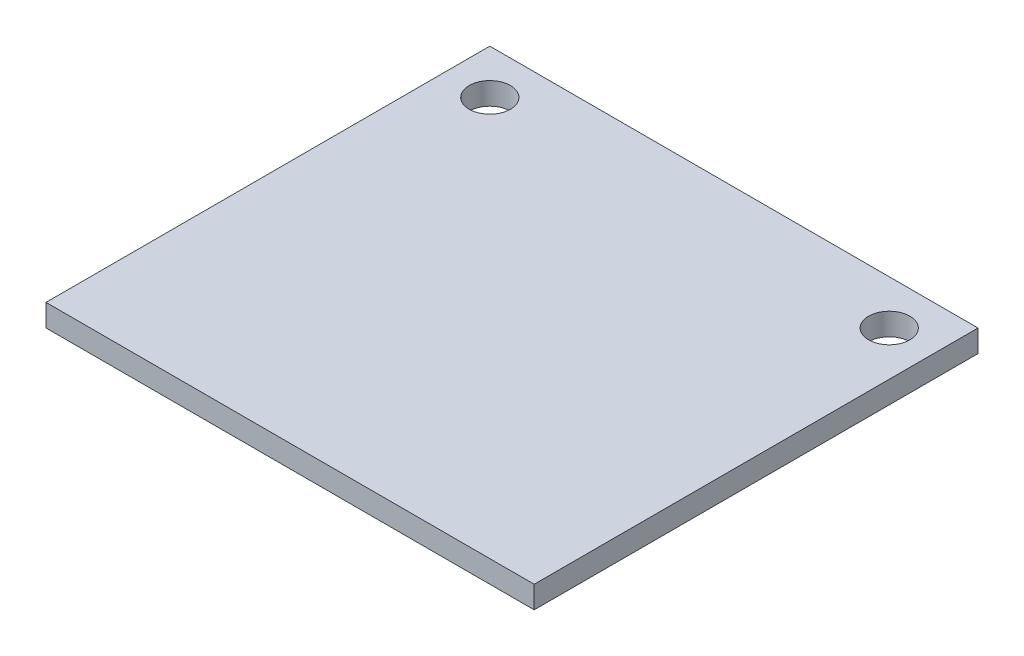
from build123d import *

# Parameters (mm, degrees)
SKETCH1_W           = 34.925
SKETCH1_H           = 31.75
BOSS_EXTRUDE1_DEPTH = 1.5875
SKETCH2_R           = 1.4732
CUT_EXTRUDE1_DEPTH  = 1.5875


with BuildPart() as part:
    # Sketch1 → Boss-Extrude1 (new body)
    with BuildSketch(Plane(origin=(0, 0, 0), x_dir=(1, 0, 0), z_dir=(0, 1, 0))):
        with Locations((17.4625, 15.875)):
            Rectangle(SKETCH1_W, SKETCH1_H)
    extrude(amount=BOSS_EXTRUDE1_DEPTH)

    # Sketch2 → Cut-Extrude1 (cut)
    with BuildSketch(Plane(origin=(0, 1.5875, 0), x_dir=(1, 0, 0), z_dir=(0, 1, 0))):
        with Locations(Location((3.175, 28.575, 0), (0, 0, 270))):
            Circle(SKETCH2_R)
        with Locations(Location((31.75, 28.575, 0), (0, 0, 270))):
            Circle(SKETCH2_R)
    extrude(amount=-CUT_EXTRUDE1_DEPTH, mode=Mode.SUBTRACT)


solid = part.part
